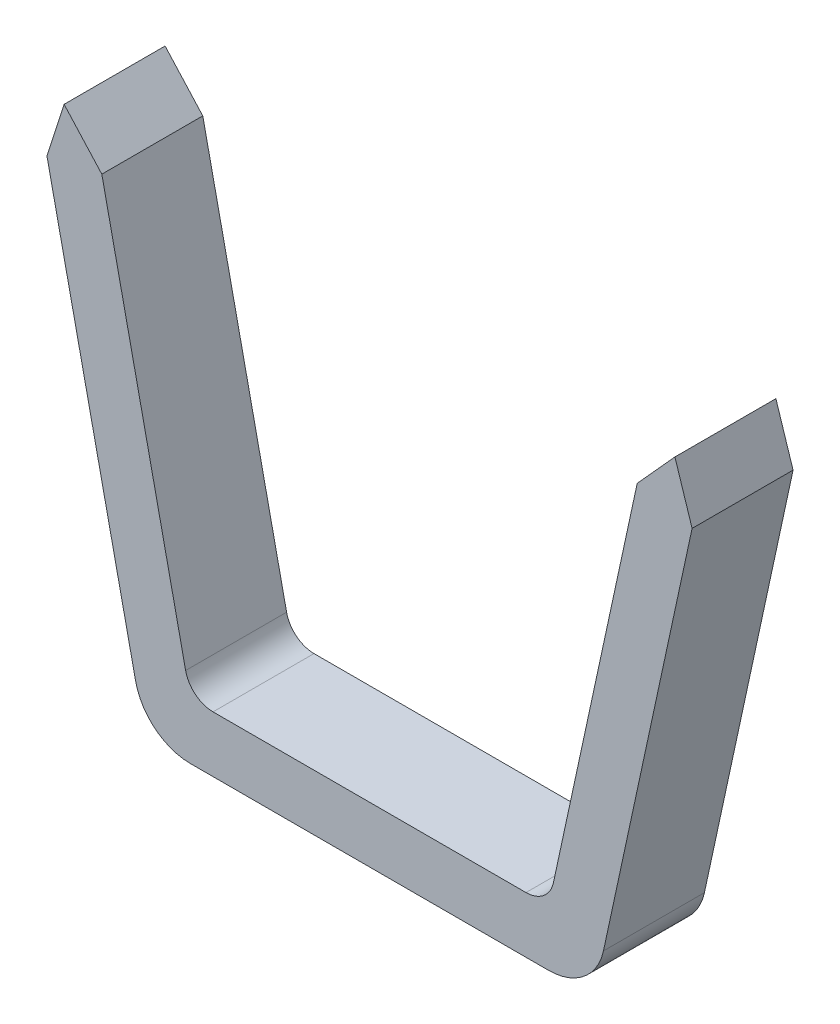
from build123d import *

# Parameters (mm, degrees)
SKETCH3_R           = 4.5
BOSS_EXTRUDE1_DEPTH = 18
FILLET1_R           = 5
FILLET2_R           = 5
CUT_EXTRUDE2_DEPTH  = 145.759283098


with BuildPart() as part:
    # Sketch3 → Boss-Extrude1 (new body)
    with BuildSketch(Plane.XY):
        with BuildLine():
            Line((-31.929873349, -122.5), (31.929873349, -122.5))
            ThreePointArc((31.929873349, -122.5), (38.210043039, -120.281996444), (41.704324989, -114.611893732))
            Line((41.704324989, -114.611893732), (73.308387301, 31.660797012))
            ThreePointArc((73.308387301, 31.660797012), (0, 122.5), (-73.308387301, 31.660797012))
            Line((-73.308387301, 31.660797012), (-41.704324989, -114.611893732))
            ThreePointArc((-41.704324989, -114.611893732), (-38.210043039, -120.281996444), (-31.929873349, -122.5))
        make_face()
        with Locations((50, -12.5)):
            Circle(SKETCH3_R, mode=Mode.SUBTRACT)
        with Locations((50, 87.5)):
            Circle(SKETCH3_R, mode=Mode.SUBTRACT)
        with Locations((-50, 87.5)):
            Circle(SKETCH3_R, mode=Mode.SUBTRACT)
        with Locations((-50, -12.5)):
            Circle(SKETCH3_R, mode=Mode.SUBTRACT)
        with BuildLine():
            Line((-31.929873349, -112.5), (-51.284518999, -22.921132901))
            ThreePointArc((-51.284518999, -22.921132901), (-39.736825778, -10.282511582), (-55.472323677, -3.538768301))
            Line((-55.472323677, -3.538768301), (-63.533935661, 33.772690744))
            ThreePointArc((-63.533935661, 33.772690744), (-64.271528905, 57.204152316), (-56.648842383, 79.373322021))
            ThreePointArc((-56.648842383, 79.373322021), (-41.800877501, 80.940702001), (-43.531035666, 95.770580418))
            ThreePointArc((-43.531035666, 95.770580418), (0, 112.5), (43.531035666, 95.770580418))
            ThreePointArc((43.531035666, 95.770580418), (41.800877501, 80.940702001), (56.648842383, 79.373322021))
            ThreePointArc((56.648842383, 79.373322021), (64.271528905, 57.204152316), (63.533935661, 33.772690744))
            Line((63.533935661, 33.772690744), (55.472323677, -3.538768301))
            ThreePointArc((55.472323677, -3.538768301), (39.736825778, -10.282511582), (51.284518999, -22.921132901))
            Line((51.284518999, -22.921132901), (31.929873349, -112.5))
            Line((31.929873349, -112.5), (-31.929873349, -112.5))
        make_face(mode=Mode.SUBTRACT)
    extrude(amount=BOSS_EXTRUDE1_DEPTH)

    # Fillet1
    fillet1_edges = [part.edges().sort_by_distance(p)[0] for p in [
        (-31.929873349, -112.5, 9),
        (31.929873349, -112.5, 9),
    ]]
    fillet(fillet1_edges, radius=FILLET1_R)

    # Fillet2
    fillet2_edges = [part.edges().sort_by_distance(p)[0] for p in [
        (51.284518999, -22.921132901, 9),
        (55.472323677, -3.538768301, 9),
        (56.648842383, 79.373322021, 9),
        (43.531035666, 95.770580418, 9),
        (-43.531035666, 95.770580418, 9),
        (-56.648842383, 79.373322021, 9),
        (-55.472323677, -3.538768301, 9),
        (-51.284518999, -22.921132901, 9),
    ]]
    fillet(fillet2_edges, radius=FILLET2_R)

    # Sketch5 → Cut-Extrude2 (cut, through all)
    with BuildSketch(Plane.XY.offset(18)):
        Polygon((47.724403212, -39.39837277), (54.444339069, -31.972010438), (57.506356145, -41.47554836), (172.58444794, 157.130363262), (-148.336678287, 157.130363262), (-57.506356145, -41.47554836), (-54.443982463, -31.973660914), (-47.723687693, -39.401684395), align=None)
    extrude(amount=-CUT_EXTRUDE2_DEPTH, mode=Mode.SUBTRACT)


solid = part.part
